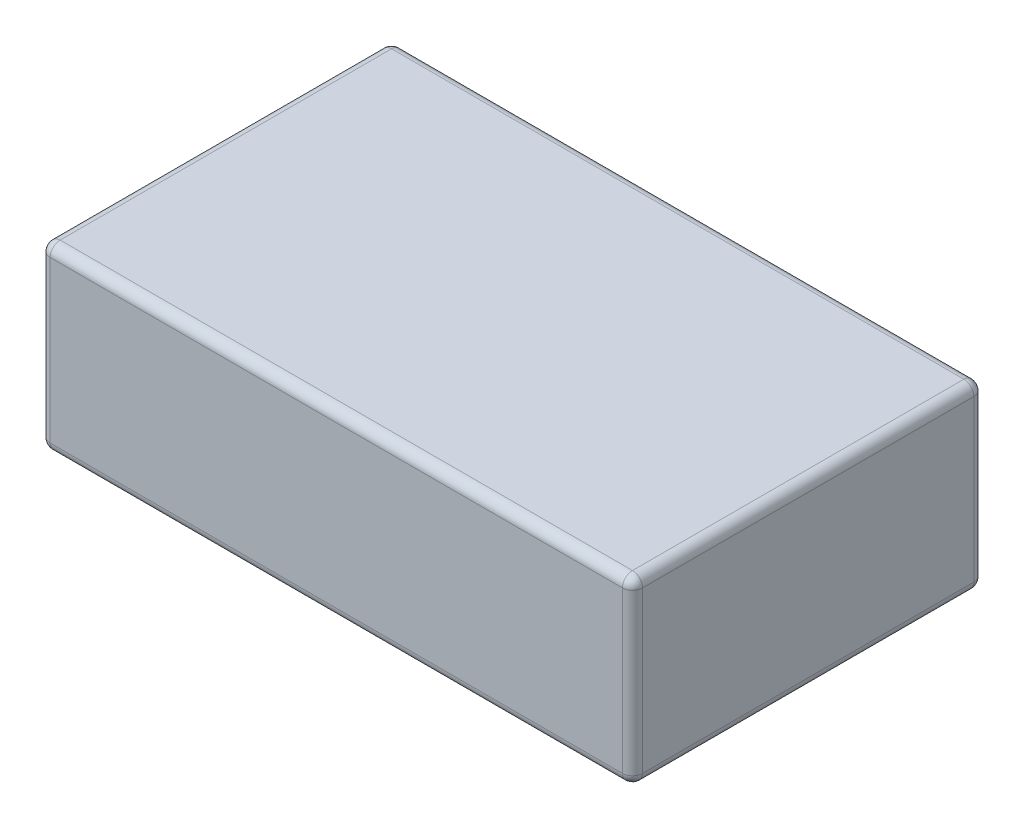
from build123d import *

# Parameters (mm, degrees)
SKETCH1_W           = 118
SKETCH1_H           = 70
BOSS_EXTRUDE1_DEPTH = 36
FILLET1_R           = 2
SKETCH2_W           = 15
SKETCH2_H           = 8
CUT_EXTRUDE1_DEPTH  = 10


with BuildPart() as part:
    # Sketch1 → Boss-Extrude1 (new body)
    with BuildSketch(Plane(origin=(0, 0, 0), x_dir=(1, 0, 0), z_dir=(0, 1, 0))):
        Rectangle(SKETCH1_W, SKETCH1_H)
    extrude(amount=BOSS_EXTRUDE1_DEPTH)

    # Fillet1
    fillet1_edges = [part.edges().sort_by_distance(p)[0] for p in [
        (-59, 36, 0),
        (0, 36, 35),
        (59, 36, 0),
        (0, 0, 35),
        (-59, 0, 0),
        (0, 0, -35),
        (59, 0, 0),
        (59, 18, 35),
        (-59, 18, 35),
        (-59, 18, -35),
        (59, 18, -35),
        (0, 36, -35),
    ]]
    fillet(fillet1_edges, radius=FILLET1_R)

    # Sketch2 → Cut-Extrude1 (cut)
    with BuildSketch(Plane.ZY.offset(59)):
        with Locations((-22.5, 18)):
            Rectangle(SKETCH2_W, SKETCH2_H)
        with Locations((23.5, 18)):
            Rectangle(SKETCH2_W, SKETCH2_H)
        with BuildLine():
            Line((-3, 20.5), (2, 20.5))
            ThreePointArc((2, 20.5), (4.5, 18), (2, 15.5))
            Line((2, 15.5), (-3, 15.5))
            ThreePointArc((-3, 15.5), (-5.5, 18), (-3, 20.5))
        make_face()
    extrude(amount=-CUT_EXTRUDE1_DEPTH, mode=Mode.SUBTRACT)


solid = part.part
